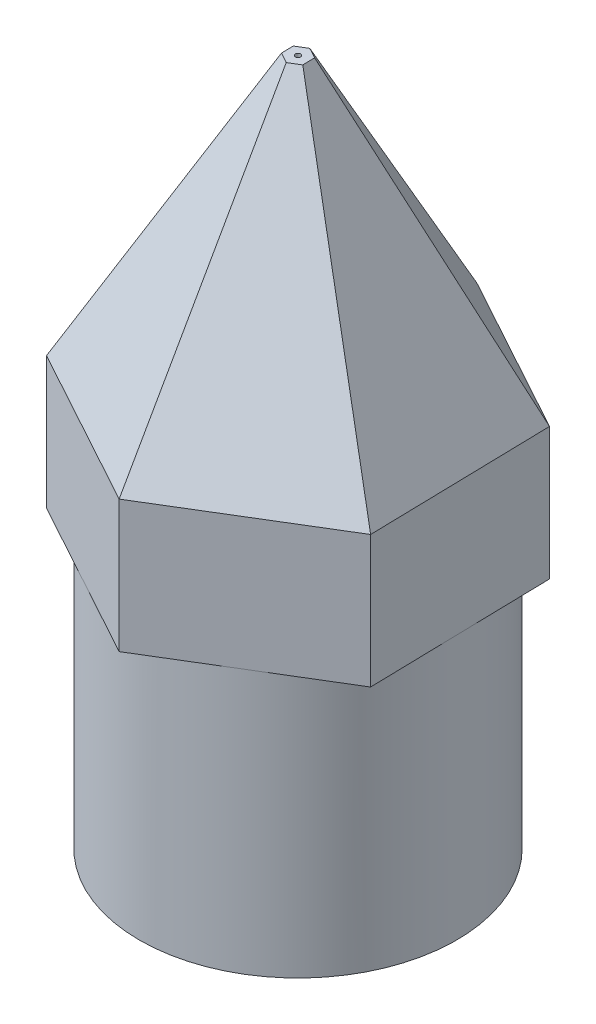
from build123d import *

# Parameters (mm, degrees)
SKETCH_1_R          = 3
EXTRUDE_1_DEPTH     = 5
EXTRUDE_2_DEPTH     = 2.5
EXTRUDE_3_DEPTH     = 5.5
EXTRUDE_3_TAPER     = 27
SKETCH_5_R          = 0.05
CUT_EXTRUDE_1_DEPTH = 14.792224458
SKETCH_6_R          = 2.127494577
CUT_EXTRUDE_2_DEPTH = 7.5
CUT_EXTRUDE_2_DRAFT = -15


with BuildPart() as part:
    # 草图1 → 凸台-拉伸1 (new body)
    with BuildSketch(Plane(origin=(0, 0, 0), x_dir=(1, 0, 0), z_dir=(0, 1, 0))):
        with Locations(Location((0, 0, 0), (0, 0, 270))):
            Circle(SKETCH_1_R)
    extrude(amount=EXTRUDE_1_DEPTH)

    # 草图2 → 凸台-拉伸2 (add)
    with BuildSketch(Plane(origin=(0, 5, 0), x_dir=(1, 0, 0), z_dir=(0, 1, 0))):
        Polygon((3.038350598, -1.663858661), (2.960119168, 1.799359473), (-0.07823143, 3.463218134), (-3.038350598, 1.663858661), (-2.960119168, -1.799359473), (0.07823143, -3.463218134), align=None)
    extrude(amount=EXTRUDE_2_DEPTH)

    # 草图4 → 凸台-拉伸3 (add)
    with BuildSketch(Plane(origin=(0, 7.5, 0), x_dir=(1, 0, 0), z_dir=(0, 1, 0))):
        Polygon((0.07823143, -3.463218134), (3.038350598, -1.663858661), (2.960119168, 1.799359473), (-0.07823143, 3.463218134), (-3.038350598, 1.663858661), (-2.960119168, -1.799359473), align=None)
    extrude(amount=EXTRUDE_3_DEPTH, taper=EXTRUDE_3_TAPER)

    # 草图5 → 切除-拉伸1 (cut, through all)
    with BuildSketch(Plane(origin=(0, 13, 0), x_dir=(1, 0, 0), z_dir=(0, 1, 0))):
        with Locations(Location((0, 0, 0), (0, 0, 270))):
            Circle(SKETCH_5_R)
    extrude(amount=-CUT_EXTRUDE_1_DEPTH, mode=Mode.SUBTRACT)


with BuildPart() as cut_extrude_2_tool:
    # 草图6 → 切除-拉伸2 (with draft: the straight prism first)
    with BuildSketch(Plane.XZ):
        with Locations((-0.05, 0)):
            Circle(SKETCH_6_R)
    extrude(amount=-CUT_EXTRUDE_2_DEPTH)
    # 切除-拉伸2: the draft: its side faces are tilted about the plane it starts from
    cut_extrude_2_sides = [cut_extrude_2_tool.faces().sort_by_distance(p)[0] for p in [
        (-2.177494577, 3.75, 0),
    ]]
    draft(cut_extrude_2_sides, Plane.XZ, CUT_EXTRUDE_2_DRAFT)


with BuildPart() as part_1:
    add(part.part)

    # 切除-拉伸2: cut by cut_extrude_2_tool
    add(cut_extrude_2_tool.part, mode=Mode.SUBTRACT)


solid = part_1.part
